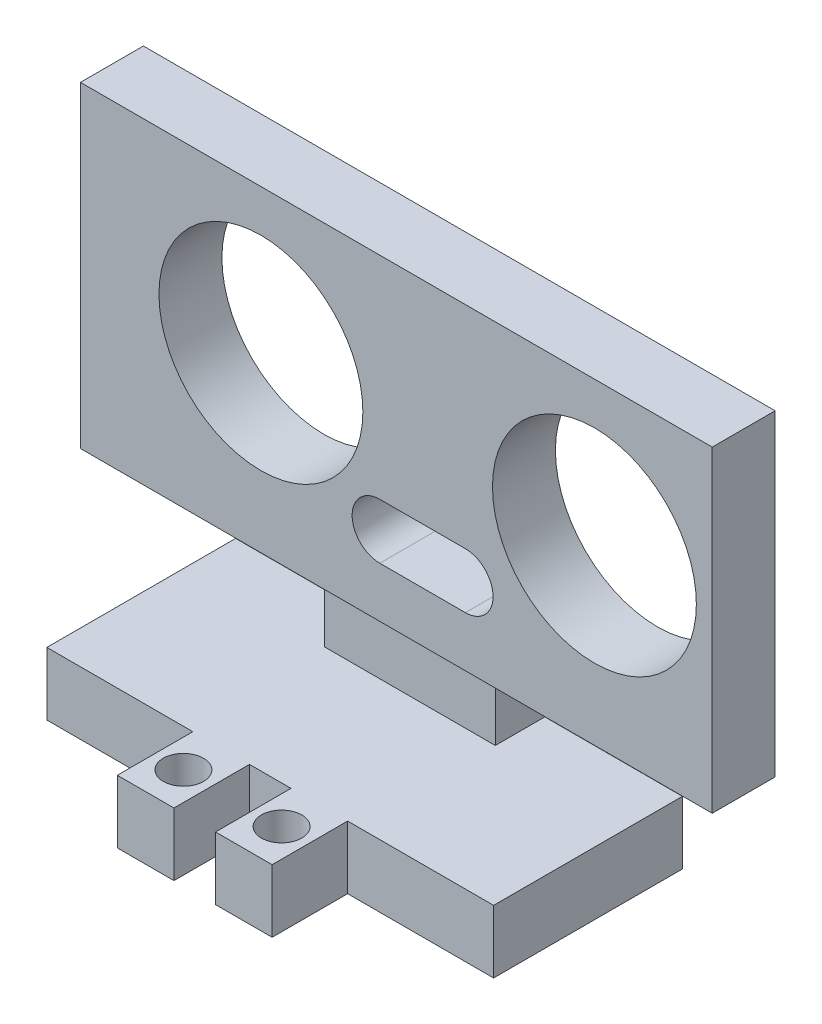
from build123d import *

# Parameters (mm, degrees)
BOSS_EXTRUDE7_DEPTH = 5
SKETCH5_W           = 13.567085075
SKETCH5_H           = 3.932792286
BOSS_EXTRUDE8_DEPTH = 5
SKETCH6_W           = 50.2
SKETCH6_H           = 5
BOSS_EXTRUDE9_DEPTH = 25.2
SKETCH7_R           = 8.1
CUT_EXTRUDE1_DEPTH  = 10
CUT_EXTRUDE2_DEPTH  = 10
SKETCH9_R           = 1.6
CUT_EXTRUDE4_DEPTH  = 10


with BuildPart() as part:
    # Sketch1 → Boss-Extrude7 (new body)
    with BuildSketch(Plane(origin=(0, 0, 0), x_dir=(1, 0, 0), z_dir=(0, 1, 0))):
        Polygon((12.769214264, 6.275388257), (24.369214264, 6.275388257), (24.369214264, 0.275388257), (28.869214264, 0.275388257), (28.869214264, 6.275388257), (32.169214264, 6.275388257), (32.169214264, 0.275388257), (36.669214264, 0.275388257), (36.669214264, 6.275388257), (48.269214264, 6.275388257), (48.269214264, 21.275388257), (12.769214264, 21.275388257), align=None)
    extrude(amount=BOSS_EXTRUDE7_DEPTH)

    # Sketch5 → Boss-Extrude8 (add)
    with BuildSketch(Plane(origin=(0, 5, 0), x_dir=(1, 0, 0), z_dir=(0, 1, 0))):
        with Locations((30.552756802, 19.308992114)):
            Rectangle(SKETCH5_W, SKETCH5_H)
    extrude(amount=BOSS_EXTRUDE8_DEPTH)

    # Sketch6 → Boss-Extrude9 (add)
    with BuildSketch(Plane(origin=(1.124638213, 10, 0), x_dir=(1, 0, 0), z_dir=(0, 1, 0))):
        with Locations((29.394576051, 18.794771585)):
            Rectangle(SKETCH6_W, SKETCH6_H)
    extrude(amount=BOSS_EXTRUDE9_DEPTH)

    # Sketch7 → Cut-Extrude1 (cut)
    with BuildSketch(Plane.XY.offset(-16.294771585)):
        with Locations((46.258900119, 23.75)):
            Circle(SKETCH7_R)
        with Locations((19.758900119, 23.75)):
            Circle(SKETCH7_R)
    extrude(amount=-CUT_EXTRUDE1_DEPTH, mode=Mode.SUBTRACT)

    # Sketch7<3> → Cut-Extrude2 (cut)
    with BuildSketch(Plane.XY.offset(-16.294771585)):
        with BuildLine():
            Line((36.006107041, 18.4), (29.206107041, 18.4))
            ThreePointArc((29.206107041, 18.4), (27.006107041, 16.2), (29.206107041, 14))
            Line((29.206107041, 14), (36.006107041, 14))
            ThreePointArc((36.006107041, 14), (38.206107041, 16.2), (36.006107041, 18.4))
        make_face()
    extrude(amount=-CUT_EXTRUDE2_DEPTH, mode=Mode.SUBTRACT)

    # Sketch9 → Cut-Extrude4 (cut)
    with BuildSketch(Plane(origin=(0, 5, 0), x_dir=(1, 0, 0), z_dir=(0, 1, 0))):
        with Locations((26.619214264, 3.275388257)):
            Circle(SKETCH9_R)
        with Locations((34.419214264, 3.275388257)):
            Circle(SKETCH9_R)
    extrude(amount=-CUT_EXTRUDE4_DEPTH, mode=Mode.SUBTRACT)


solid = part.part
